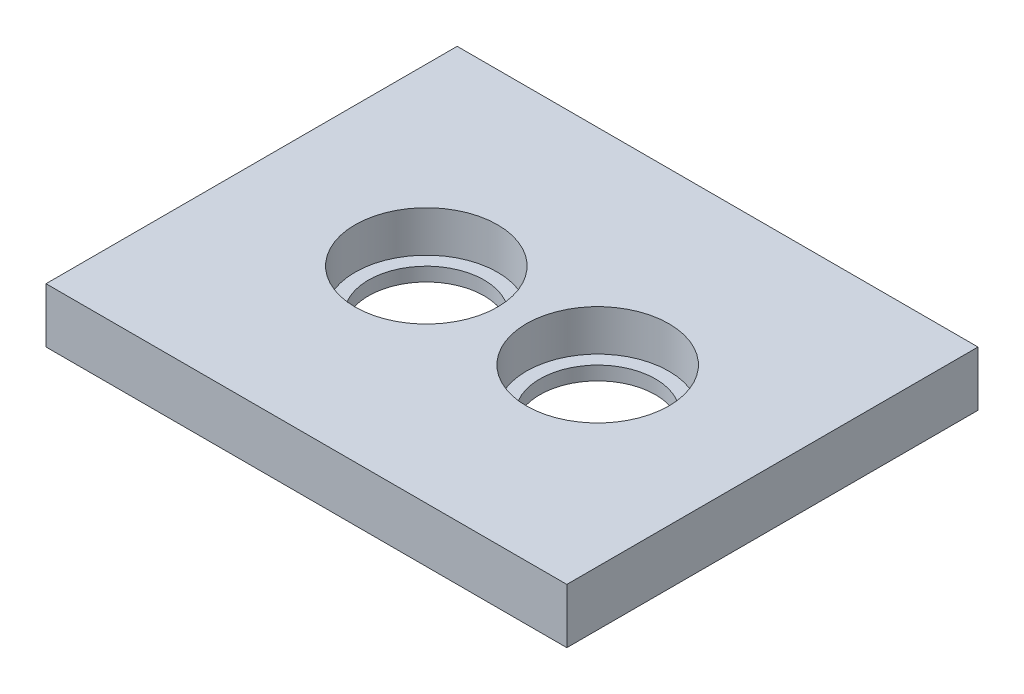
from build123d import *

# Parameters (mm, degrees)
SKETCH1_W           = 190
SKETCH1_H           = 150
BOSS_EXTRUDE1_DEPTH = 20
CUT_EXTRUDE1_REACH  = 124.678
SKETCH2_R           = 26
BOSS_EXTRUDE2_START = -5
SKETCH8_R           = 26
SKETCH8_R_2         = 21.1
BOSS_EXTRUDE2_DEPTH = 5


with BuildPart() as part:
    # Sketch1 → Boss-Extrude1 (new body)
    with BuildSketch(Plane(origin=(0, 0, 0), x_dir=(1, 0, 0), z_dir=(0, 1, 0))):
        Rectangle(SKETCH1_W, SKETCH1_H)
    extrude(amount=BOSS_EXTRUDE1_DEPTH)

    # Sketch2 → Cut-Extrude1 (cut, up to next)
    with BuildSketch(Plane(origin=(0, 20, 0), x_dir=(1, 0, 0), z_dir=(0, 1, 0)), mode=Mode.PRIVATE) as cut_extrude1_sk1:
        with Locations(Location((31.25, 0, 0), (0, 0, 270))):
            Circle(SKETCH2_R)
    cut_extrude1_tool1 = extrude(cut_extrude1_sk1.sketch, amount=-CUT_EXTRUDE1_REACH, mode=Mode.PRIVATE) & part.part
    # Sketch2 → Cut-Extrude1 (cut, up to next)
    with BuildSketch(Plane(origin=(0, 20, 0), x_dir=(1, 0, 0), z_dir=(0, 1, 0)), mode=Mode.PRIVATE) as cut_extrude1_sk2:
        with Locations(Location((-31.25, 0, 0), (0, 0, 270))):
            Circle(SKETCH2_R)
    cut_extrude1_tool2 = extrude(cut_extrude1_sk2.sketch, amount=-CUT_EXTRUDE1_REACH, mode=Mode.PRIVATE) & part.part
    add(cut_extrude1_tool1.solids().sort_by_distance((31.25, 20, 0))[0], mode=Mode.SUBTRACT)
    add(cut_extrude1_tool2.solids().sort_by_distance((-31.25, 20, 0))[0], mode=Mode.SUBTRACT)

    # Sketch8 → Boss-Extrude2 (add)
    # profile 1 of 2: a face of its own
    with BuildSketch(Plane.XZ.offset(BOSS_EXTRUDE2_START)):
        with Locations(Location((31.25, 0, 0), (0, 0, 90))):
            Circle(SKETCH8_R)
        with Locations(Location((31.25, 0, 0), (0, 0, 270))):
            Circle(SKETCH8_R_2, mode=Mode.SUBTRACT)
    # profile 2 of 2: a face of its own
    with BuildSketch(Plane.XZ.offset(BOSS_EXTRUDE2_START)):
        with Locations(Location((-31.25, 0, 0), (0, 0, 90))):
            Circle(SKETCH8_R)
        with Locations(Location((-31.25, 0, 0), (0, 0, 270))):
            Circle(SKETCH8_R_2, mode=Mode.SUBTRACT)
    extrude(amount=BOSS_EXTRUDE2_DEPTH)


solid = part.part
